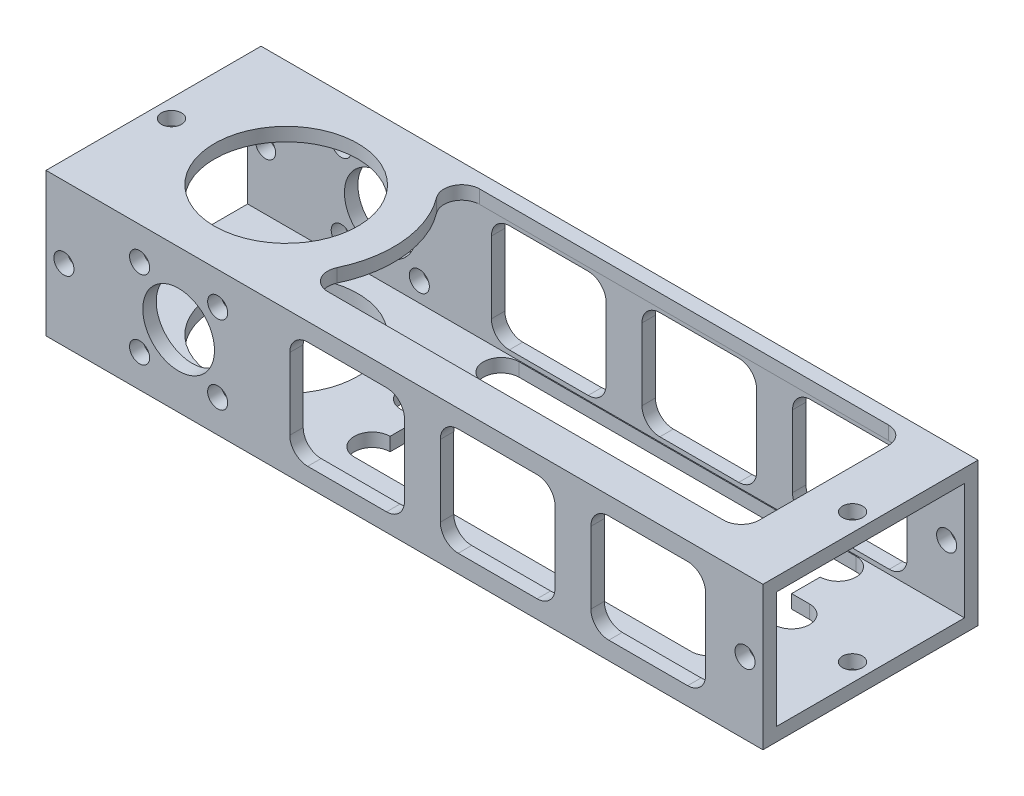
from build123d import *

# Parameters (mm, degrees)
SKETCH1_W                            = 38.1
SKETCH1_H                            = 25.4
SKETCH1_W_2                          = 33.3375
SKETCH1_H_2                          = 20.6375
BOSS_EXTRUDE1_DEPTH                  = 127
SKETCH2_R                            = 12.7
CUT_EXTRUDE1_DEPTH                   = 136.002851822
SKETCH3_R                            = 6.35
SKETCH3_R_2                          = 1.778
CUT_EXTRUDE2_DEPTH                   = 136.002851822
CUT_EXTRUDE3_REACH                   = 137.003
F_4_0_209_DIAMETER_HOLE1_D           = 3.556
F_4_0_209_DIAMETER_HOLE1_ON_FACE_2_D = 3.556
F_4_0_209_DIAMETER_HOLE1_ON_FACE_3_D = 3.556
F_4_0_209_DIAMETER_HOLE1_ON_FACE_4_D = 3.556
CUT_EXTRUDE4_REACH                   = 137.003


with BuildPart() as part:
    # Sketch1 → Boss-Extrude1 (new body)
    with BuildSketch(Plane(origin=(0, 0, 0), x_dir=(0, 0, -1), z_dir=(1, 0, 0))):
        with Locations((19.05, 12.7)):
            Rectangle(SKETCH1_W, SKETCH1_H)
        with Locations((19.05, 12.7)):
            Rectangle(SKETCH1_W_2, SKETCH1_H_2, mode=Mode.SUBTRACT)
    extrude(amount=BOSS_EXTRUDE1_DEPTH)

    # Sketch2 → Cut-Extrude1 (cut, through all)
    with BuildSketch(Plane(origin=(0, 25.4, 0), x_dir=(1, 0, 0), z_dir=(0, 1, 0))):
        with Locations(Location((23.495, 19.05, 0), (0, 0, 270))):
            Circle(SKETCH2_R)
    extrude(amount=-CUT_EXTRUDE1_DEPTH, mode=Mode.SUBTRACT)

    # Sketch3 → Cut-Extrude2 (cut, through all)
    with BuildSketch(Plane.XY):
        with Locations((23.495, 12.7)):
            Circle(SKETCH3_R)
        with Locations((16.580202787, 19.614797213)):
            Circle(SKETCH3_R_2)
        with Locations((16.580202787, 5.785202787)):
            Circle(SKETCH3_R_2)
        with Locations((30.409797213, 5.785202787)):
            Circle(SKETCH3_R_2)
        with Locations((30.409797213, 19.614797213)):
            Circle(SKETCH3_R_2)
        with BuildLine():
            Line((46.355, 22.225), (60.325, 22.225))
            ThreePointArc((60.325, 22.225), (62.57006403, 21.29506403), (63.5, 19.05))
            Line((63.5, 19.05), (63.5, 6.35))
            ThreePointArc((63.5, 6.35), (62.57006403, 4.10493597), (60.325, 3.175))
            Line((60.325, 3.175), (46.355, 3.175))
            ThreePointArc((46.355, 3.175), (44.10993597, 4.10493597), (43.18, 6.35))
            Line((43.18, 6.35), (43.18, 19.05))
            ThreePointArc((43.18, 19.05), (44.10993597, 21.29506403), (46.355, 22.225))
        make_face()
        with BuildLine():
            Line((73.025, 22.225), (86.995, 22.225))
            ThreePointArc((86.995, 22.225), (89.24006403, 21.29506403), (90.17, 19.05))
            Line((90.17, 19.05), (90.17, 6.35))
            ThreePointArc((90.17, 6.35), (89.24006403, 4.10493597), (86.995, 3.175))
            Line((86.995, 3.175), (73.025, 3.175))
            ThreePointArc((73.025, 3.175), (70.77993597, 4.10493597), (69.85, 6.35))
            Line((69.85, 6.35), (69.85, 19.05))
            ThreePointArc((69.85, 19.05), (70.77993597, 21.29506403), (73.025, 22.225))
        make_face()
        with BuildLine():
            Line((99.695, 22.225), (113.665, 22.225))
            ThreePointArc((113.665, 22.225), (115.91006403, 21.29506403), (116.84, 19.05))
            Line((116.84, 19.05), (116.84, 6.35))
            ThreePointArc((116.84, 6.35), (115.91006403, 4.10493597), (113.665, 3.175))
            Line((113.665, 3.175), (99.695, 3.175))
            ThreePointArc((99.695, 3.175), (97.44993597, 4.10493597), (96.52, 6.35))
            Line((96.52, 6.35), (96.52, 19.05))
            ThreePointArc((96.52, 19.05), (97.44993597, 21.29506403), (99.695, 22.225))
        make_face()
    extrude(amount=-CUT_EXTRUDE2_DEPTH, mode=Mode.SUBTRACT)

    # Sketch4 → Cut-Extrude3 (cut, up to next)
    with BuildSketch(Plane(origin=(0, 25.4, 0), x_dir=(1, 0, 0), z_dir=(0, 1, 0)), mode=Mode.PRIVATE) as cut_extrude3_sk1:
        with BuildLine():
            Line((43.575463142, 6.35), (113.665, 6.35))
            ThreePointArc((113.665, 6.35), (115.91006403, 7.27993597), (116.84, 9.525))
            Line((116.84, 9.525), (116.84, 32.385))
            ThreePointArc((116.84, 32.385), (115.91006403, 34.63006403), (113.665, 35.56))
            Line((113.665, 35.56), (41.275, 35.56))
            ThreePointArc((41.275, 35.56), (38.435193669, 33.804903166), (38.735, 30.48))
            ThreePointArc((38.735, 30.48), (42.449267423, 20.957418792), (40.70682555, 10.885714286))
            ThreePointArc((40.70682555, 10.885714286), (40.892098383, 7.827891114), (43.575463142, 6.35))
        make_face()
    cut_extrude3_tool1 = extrude(cut_extrude3_sk1.sketch, amount=-CUT_EXTRUDE3_REACH, mode=Mode.PRIVATE) & part.part
    add(cut_extrude3_tool1.solids().sort_by_distance((78.81497, 25.4, -21.04719))[0], mode=Mode.SUBTRACT)

    # #4 (0.209) Diameter Hole1 (through all)
    with Locations(Plane(origin=(3.175, 25.4, -19.05), x_dir=(0, 0, 1), z_dir=(0, 1, 0))):
        with Locations((0, 0), (0, 120.65)):
            Hole(F_4_0_209_DIAMETER_HOLE1_D / 2)

    # #4 (0.209) Diameter Hole1 on face 2 (through all)
    with Locations(Plane(origin=(123.825, 12.7, 0), x_dir=(1, 0, 0), z_dir=(0, 0, 1))):
        with Locations((0, 0), (-120.65, 0)):
            Hole(F_4_0_209_DIAMETER_HOLE1_ON_FACE_2_D / 2)

    # #4 (0.209) Diameter Hole1 on face 3 (through all)
    with Locations(Plane(origin=(123.825, 0, -19.05), x_dir=(0, 0, -1), z_dir=(0, -1, 0))):
        with Locations((0, 0), (0, -120.65)):
            Hole(F_4_0_209_DIAMETER_HOLE1_ON_FACE_3_D / 2)

    # #4 (0.209) Diameter Hole1 on face 4 (through all)
    with Locations(Plane(origin=(123.825, 12.7, -38.1), x_dir=(-1, 0, 0), z_dir=(0, 0, -1))):
        with Locations((0, 0), (120.65, 0)):
            Hole(F_4_0_209_DIAMETER_HOLE1_ON_FACE_4_D / 2)

    # Sketch6 → Cut-Extrude4 (cut, up to next)
    with BuildSketch(Plane.XZ, mode=Mode.PRIVATE) as cut_extrude4_sk1:
        with BuildLine():
            Line((48.26, -35.56), (107.95, -35.56))
            ThreePointArc((107.95, -35.56), (111.125, -32.385), (107.95, -29.21))
            Line((107.95, -29.21), (107.95, -24.13))
            Line((107.95, -24.13), (111.125, -24.13))
            ThreePointArc((111.125, -24.13), (114.3, -20.955), (111.125, -17.78))
            Line((111.125, -17.78), (107.95, -17.78))
            Line((107.95, -17.78), (107.95, -12.7))
            ThreePointArc((107.95, -12.7), (111.125, -9.525), (107.95, -6.35))
            Line((107.95, -6.35), (48.26, -6.35))
            ThreePointArc((48.26, -6.35), (45.085, -9.525), (48.26, -12.7))
            Line((48.26, -12.7), (48.26, -17.78))
            Line((48.26, -17.78), (45.085, -17.78))
            ThreePointArc((45.085, -17.78), (41.91, -20.955), (45.085, -24.13))
            Line((45.085, -24.13), (48.26, -24.13))
            Line((48.26, -24.13), (48.26, -29.21))
            ThreePointArc((48.26, -29.21), (45.085, -32.385), (48.26, -35.56))
        make_face()
    cut_extrude4_tool1 = extrude(cut_extrude4_sk1.sketch, amount=-CUT_EXTRUDE4_REACH, mode=Mode.PRIVATE) & part.part
    add(cut_extrude4_tool1.solids().sort_by_distance((78.105, 0, -20.955))[0], mode=Mode.SUBTRACT)


solid = part.part
